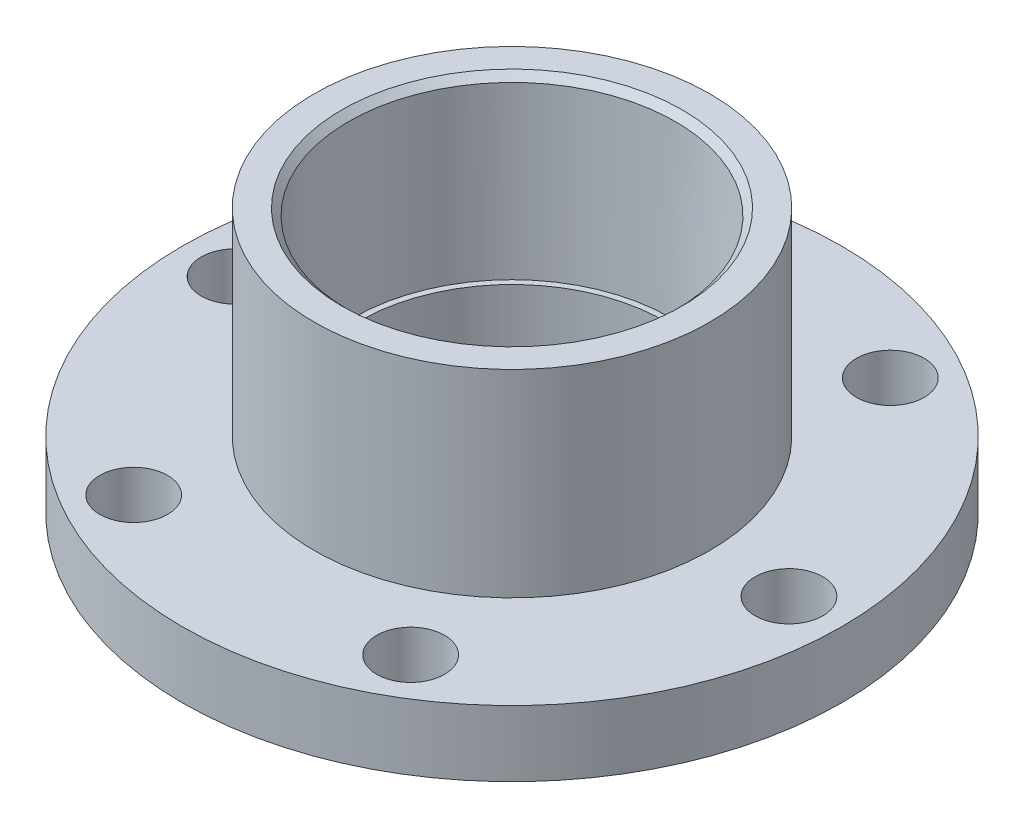
from build123d import *

# Parameters (mm, degrees)
F_1_4_CLEARANCE_HOLE1_D = 6.5278
CIRPATTERN1_COUNT       = 6


with BuildPart() as part:
    # Sketch4 → Revolve1 (revolve)
    with BuildSketch(Plane.XY, mode=Mode.PRIVATE) as revolve1_sk:
        with BuildLine():
            Line((0, 25.4), (19.05, 25.4))
            Line((19.05, 25.4), (19.05, 6.35))
            Line((19.05, 6.35), (31.75, 6.35))
            Line((31.75, 6.35), (31.75, 0))
            Line((31.75, 0), (21.5773, 0))
            Line((21.5773, 0), (21.5773, 2.2606))
            ThreePointArc((21.5773, 2.2606), (21.465707684, 2.530007684), (21.1963, 2.6416))
            Line((21.1963, 2.6416), (17.3355, 2.6416))
            ThreePointArc((17.3355, 2.6416), (17.066092316, 2.530007684), (16.9545, 2.2606))
            Line((16.9545, 2.2606), (16.9545, 0))
            Line((16.9545, 0), (0, 0))
            Line((0, 0), (0, 25.4))
        make_face()
    revolve(revolve1_sk.sketch.rotate(Axis((0, 0, 0), (0, 1, 0)), 90), axis=Axis((0, 0, 0), (0, 1, 0)))

    # Sketch6 → 1 NPT Tapped Hole2 (revolve, cut)
    with BuildSketch(Plane(origin=(0, 25.4, 0), x_dir=(0, 0, 1), z_dir=(1, 0, 0))):
        Polygon((0, 0), (0, 25.4), (14.684375, 25.4), (14.684375, 16.764), (15.247532824, 16.764), (15.7299152, 0.6530848), (16.383, 0), align=None)
    revolve(axis=Axis((0, 31.75, 0), (0, -1, 0)), mode=Mode.SUBTRACT)

    # 1/4 Clearance Hole1 (through all)
    with Locations(Plane(origin=(0, 6.35, 0), x_dir=(1, 0, 0), z_dir=(0, 1, 0))):
        with Locations((26.67, 0)):
            f_1_4_clearance_hole1 = Hole(F_1_4_CLEARANCE_HOLE1_D / 2)

    # CirPattern1: 1/4 Clearance Hole1 ×6 about axis
    cirpattern1_axis = Axis((0, 0, 0), (0, 1, 0))
    for i in range(1, CIRPATTERN1_COUNT):
        add(f_1_4_clearance_hole1.rotate(cirpattern1_axis, i * 360 / CIRPATTERN1_COUNT), mode=Mode.SUBTRACT)


solid = part.part
